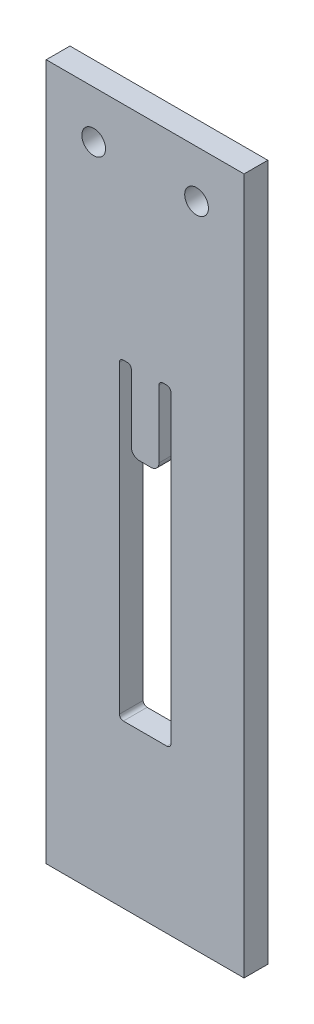
from build123d import *

# Parameters (mm, degrees)
SKETCH1_W           = 25
SKETCH1_H           = 88
BOSS_EXTRUDE1_DEPTH = 3
SKETCH2_R           = 1.5
CUT_EXTRUDE1_DEPTH  = 3
CUT_EXTRUDE2_DEPTH  = 10


with BuildPart() as part:
    # Sketch1 → Boss-Extrude1 (new body)
    with BuildSketch(Plane.XY):
        with Locations((12.5, 44)):
            Rectangle(SKETCH1_W, SKETCH1_H)
    extrude(amount=BOSS_EXTRUDE1_DEPTH)

    # Sketch2 → Cut-Extrude1 (cut)
    with BuildSketch(Plane.XY.offset(3)):
        with Locations((19, 82)):
            Circle(SKETCH2_R)
        with Locations((6, 82)):
            Circle(SKETCH2_R)
    extrude(amount=-CUT_EXTRUDE1_DEPTH, mode=Mode.SUBTRACT)

    # Sketch3 → Cut-Extrude2 (cut)
    with BuildSketch(Plane.XY.offset(3)):
        with BuildLine():
            Line((9.75, 20.5), (15.25, 20.5))
            ThreePointArc((15.25, 20.5), (15.603553391, 20.646446609), (15.75, 21))
            Line((15.75, 21), (15.75, 59.5))
            ThreePointArc((15.75, 59.5), (15.603553391, 59.853553391), (15.25, 60))
            Line((15.25, 60), (14.75, 60))
            ThreePointArc((14.75, 60), (14.396446609, 59.853553391), (14.25, 59.5))
            Line((14.25, 59.5), (14.25, 51))
            ThreePointArc((14.25, 51), (13.957106781, 50.292893219), (13.25, 50))
            Line((13.25, 50), (11.75, 50))
            ThreePointArc((11.75, 50), (11.042893219, 50.292893219), (10.75, 51))
            Line((10.75, 51), (10.75, 59.5))
            ThreePointArc((10.75, 59.5), (10.603553391, 59.853553391), (10.25, 60))
            Line((10.25, 60), (9.75, 60))
            ThreePointArc((9.75, 60), (9.396446609, 59.853553391), (9.25, 59.5))
            Line((9.25, 59.5), (9.25, 21))
            ThreePointArc((9.25, 21), (9.396446609, 20.646446609), (9.75, 20.5))
        make_face()
    extrude(amount=-CUT_EXTRUDE2_DEPTH, mode=Mode.SUBTRACT)


solid = part.part
